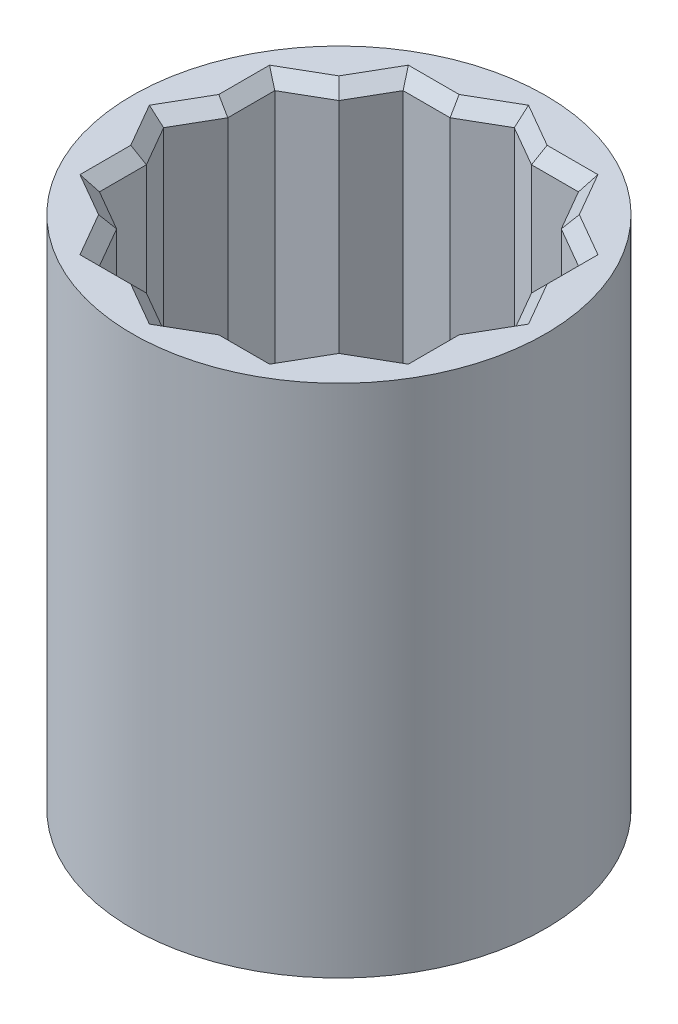
from build123d import *

# Parameters (mm, degrees)
SKETCH1_R           = 9.779
BOSS_EXTRUDE1_DEPTH = 24.384
SKETCH2_W           = 9.652
SKETCH2_H           = 9.652
CUT_EXTRUDE1_DEPTH  = 11.43
CUT_EXTRUDE2_DEPTH  = 12.954
CIRPATTERN1_COUNT   = 2
CIRPATTERN1_ANGLE   = 30
CHAMFER1_SIZE       = 0.5842


with BuildPart() as part:
    # Sketch1 → Boss-Extrude1 (new body)
    with BuildSketch(Plane(origin=(0, 0, 0), x_dir=(1, 0, 0), z_dir=(0, 1, 0))):
        with Locations(Location((0, 0, 0), (0, 0, 90))):
            Circle(SKETCH1_R)
    extrude(amount=BOSS_EXTRUDE1_DEPTH)

    # Sketch2 → Cut-Extrude1 (cut)
    with BuildSketch(Plane.XZ):
        Rectangle(SKETCH2_W, SKETCH2_H)
    extrude(amount=-CUT_EXTRUDE1_DEPTH, mode=Mode.SUBTRACT)

    # Sketch3 → Cut-Extrude2 (cut)
    with BuildSketch(Plane(origin=(0, 24.384, 0), x_dir=(1, 0, 0), z_dir=(0, 1, 0))):
        Polygon((8.30021841, 0), (4.150109205, 7.1882), (-4.150109205, 7.1882), (-8.30021841, 0), (-4.150109205, -7.1882), (4.150109205, -7.1882), align=None)
    cut_extrude2 = extrude(amount=-CUT_EXTRUDE2_DEPTH, mode=Mode.SUBTRACT)

    # CirPattern1: Cut-Extrude2 ×2 about axis
    cirpattern1_axis = Axis((0, 0, 0), (0, 1, 0))
    for i in range(1, CIRPATTERN1_COUNT):
        add(cut_extrude2.rotate(cirpattern1_axis, i * CIRPATTERN1_ANGLE / (CIRPATTERN1_COUNT - 1)), mode=Mode.SUBTRACT)

    # Chamfer1
    chamfer1_edges = [part.edges().sort_by_distance(p)[0] for p in [
        (4.70611841, 24.384, 6.225163807),
        (7.744209205, 24.384, -0.963036193),
        (3.038090795, 24.384, -7.1882),
        (-4.70611841, 24.384, -6.225163807),
        (-7.744209205, 24.384, 0.963036193),
        (-3.038090795, 24.384, 7.1882),
        (7.744209205, 24.384, 0.963036193),
        (3.038090795, 24.384, 7.1882),
        (-4.70611841, 24.384, 6.225163807),
        (-7.744209205, 24.384, -0.963036193),
        (-3.038090795, 24.384, -7.1882),
        (4.70611841, 24.384, -6.225163807),
        (7.1882, 24.384, -3.038090795),
        (6.225163807, 24.384, -4.70611841),
        (0.963036193, 24.384, -7.744209205),
        (-0.963036193, 24.384, -7.744209205),
        (-6.225163807, 24.384, -4.70611841),
        (-7.1882, 24.384, -3.038090795),
        (-7.1882, 24.384, 3.038090795),
        (-6.225163807, 24.384, 4.70611841),
        (-0.963036193, 24.384, 7.744209205),
        (0.963036193, 24.384, 7.744209205),
        (6.225163807, 24.384, 4.70611841),
        (7.1882, 24.384, 3.038090795),
    ]]
    chamfer(chamfer1_edges, length=CHAMFER1_SIZE)


solid = part.part
